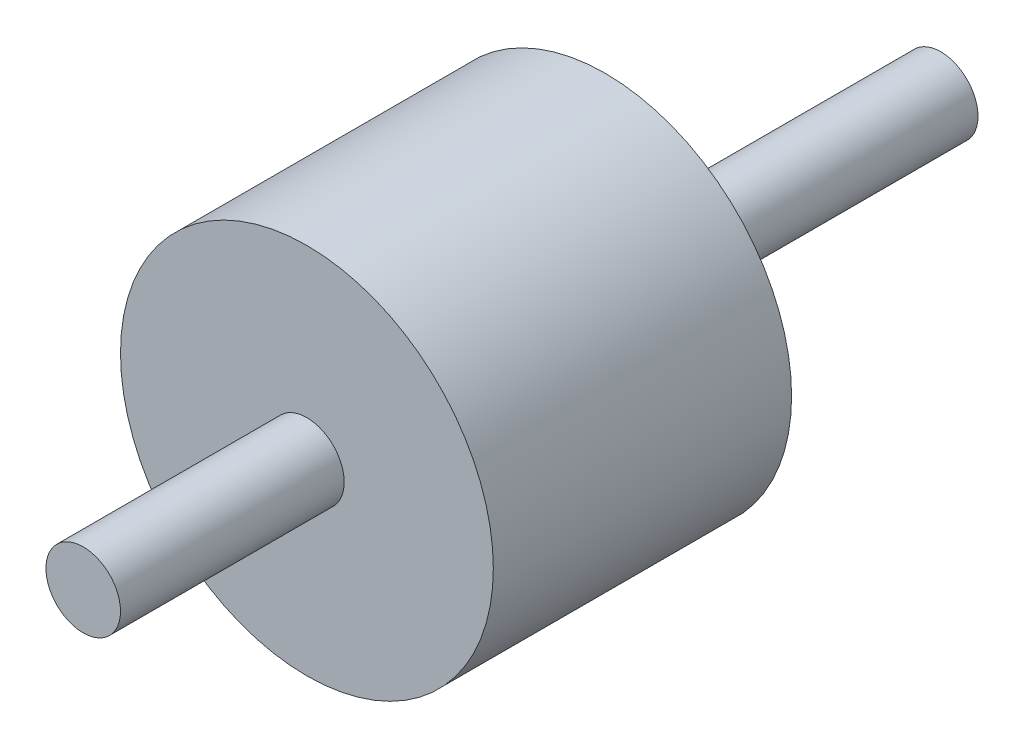
from build123d import *

# Parameters (mm, degrees)
SKETCH2_R           = 5
BOSS_EXTRUDE1_DEPTH = 115
SKETCH3_R           = 25
BOSS_EXTRUDE2_DEPTH = 40
SKETCH4_R           = 7.5
BOSS_EXTRUDE3_DEPTH = 10


with BuildPart() as part:
    # Sketch2 → Boss-Extrude1 (new body)
    with BuildSketch(Plane.XY):
        Circle(SKETCH2_R)
    extrude(amount=BOSS_EXTRUDE1_DEPTH)

    # Sketch3 → Boss-Extrude2 (add)
    with BuildSketch(Plane.XY.offset(85)):
        Circle(SKETCH3_R)
    extrude(amount=-BOSS_EXTRUDE2_DEPTH)

    # Sketch4 → Boss-Extrude3 (add)
    with BuildSketch(Plane(origin=(0, 0, 35), x_dir=(-1, 0, 0), z_dir=(0, 0, -1))):
        Circle(SKETCH4_R)
    extrude(amount=-BOSS_EXTRUDE3_DEPTH)


solid = part.part
